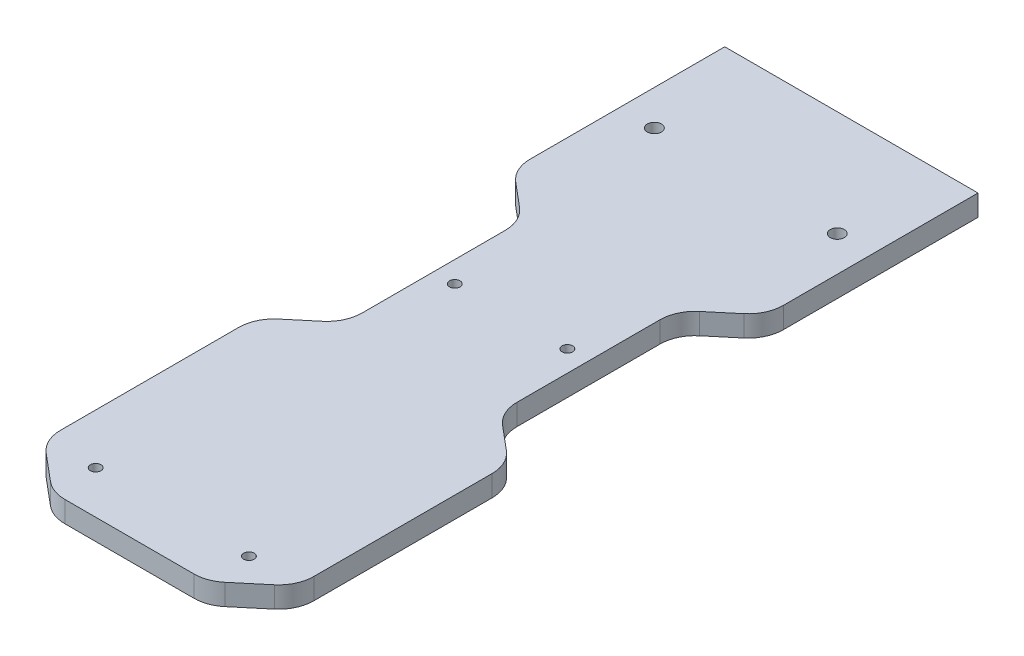
from build123d import *

# Parameters (mm, degrees)
BOSS_EXTRUDE1_DEPTH = 6
FILLET1_R           = 10
SKETCH2_R           = 2.5
CUT_EXTRUDE1_DEPTH  = 6
SKETCH5_R           = 5.997593501
BOSS_EXTRUDE2_DEPTH = 6
FILLET2_R           = 10
SKETCH6_R           = 1.5
CUT_EXTRUDE2_DEPTH  = 10
SKETCH7_R           = 1.5
CUT_EXTRUDE3_DEPTH  = 10
SKETCH8_R           = 2
CUT_EXTRUDE4_DEPTH  = 10


with BuildPart() as part:
    # Sketch1 → Boss-Extrude1 (new body)
    with BuildSketch(Plane(origin=(0, 0, 0), x_dir=(1, 0, 0), z_dir=(0, 1, 0))):
        Polygon((21.213083016, -102.227633762), (35.213083016, -90.480238926), (35.213083016, -30.480238926), (21.213083016, -18.73284409), (21.213083016, 31.26715591), (35.213083016, 43.014550747), (35.213083016, 103.014550747), (-36.786916984, 103.014550747), (-36.786916984, 43.014550747), (-22.786916984, 31.26715591), (-22.786916984, -18.73284409), (-36.786916984, -30.480238926), (-36.786916984, -90.480238926), (-22.786916984, -102.227633762), align=None)
    extrude(amount=BOSS_EXTRUDE1_DEPTH)

    # Fillet1
    fillet1_edges = [part.edges().sort_by_distance(p)[0] for p in [
        (-22.786916984, 3, 102.227633762),
        (-36.786916984, 3, 90.480238926),
        (-36.786916984, 3, 30.480238926),
        (-22.786916984, 3, 18.73284409),
        (21.213083016, 3, 18.73284409),
        (35.213083016, 3, 30.480238926),
        (35.213083016, 3, 90.480238926),
        (21.213083016, 3, 102.227633762),
    ]]
    fillet(fillet1_edges, radius=FILLET1_R)

    # Sketch2 → Cut-Extrude1 (cut)
    with BuildSketch(Plane.XZ):
        with Locations(Location((-0.786916984, 60.480238926, 0), (0, 0, 270))):
            Circle(SKETCH2_R)
    extrude(amount=-CUT_EXTRUDE1_DEPTH, mode=Mode.SUBTRACT)

    # Sketch5 → Boss-Extrude2 (add)
    with BuildSketch(Plane.XZ):
        with Locations((-0.786916984, 60.480238926)):
            Circle(SKETCH5_R)
    extrude(amount=-BOSS_EXTRUDE2_DEPTH)

    # Fillet2
    fillet2_edges = [part.edges().sort_by_distance(p)[0] for p in [
        (-22.786916984, 3, -31.26715591),
        (-36.786916984, 3, -43.014550747),
        (35.213083016, 3, -43.014550747),
        (21.213083016, 3, -31.26715591),
    ]]
    fillet(fillet2_edges, radius=FILLET2_R)

    # Sketch6 → Cut-Extrude2 (cut)
    with BuildSketch(Plane(origin=(0, 6, 0), x_dir=(1, 0, 0), z_dir=(0, 1, 0))):
        with Locations(Location((15.213083016, 6.26715591, 0), (0, 0, 270))):
            Circle(SKETCH6_R)
        with Locations(Location((-16.786916984, 6.26715591, 0), (0, 0, 270))):
            Circle(SKETCH6_R)
    extrude(amount=-CUT_EXTRUDE2_DEPTH, mode=Mode.SUBTRACT)

    # Sketch7 → Cut-Extrude3 (cut)
    with BuildSketch(Plane(origin=(0, 6, 0), x_dir=(1, 0, 0), z_dir=(0, 1, 0))):
        with Locations(Location((20.993582106, -90.043344962, 0), (0, 0, 270))):
            Circle(SKETCH7_R)
        with Locations(Location((-22.567416075, -90.043344962, 0), (0, 0, 270))):
            Circle(SKETCH7_R)
    extrude(amount=-CUT_EXTRUDE3_DEPTH, mode=Mode.SUBTRACT)

    # Sketch8 → Cut-Extrude4 (cut)
    with BuildSketch(Plane(origin=(0, 0, 0), x_dir=(-1, 0, 0), z_dir=(0, -1, 0))):
        with Locations(Location((26.786916984, 73.014550747, 0), (0, 0, 90))):
            Circle(SKETCH8_R)
        with Locations(Location((-25.213083016, 73.014550747, 0), (0, 0, 90))):
            Circle(SKETCH8_R)
    extrude(amount=-CUT_EXTRUDE4_DEPTH, mode=Mode.SUBTRACT)


solid = part.part
